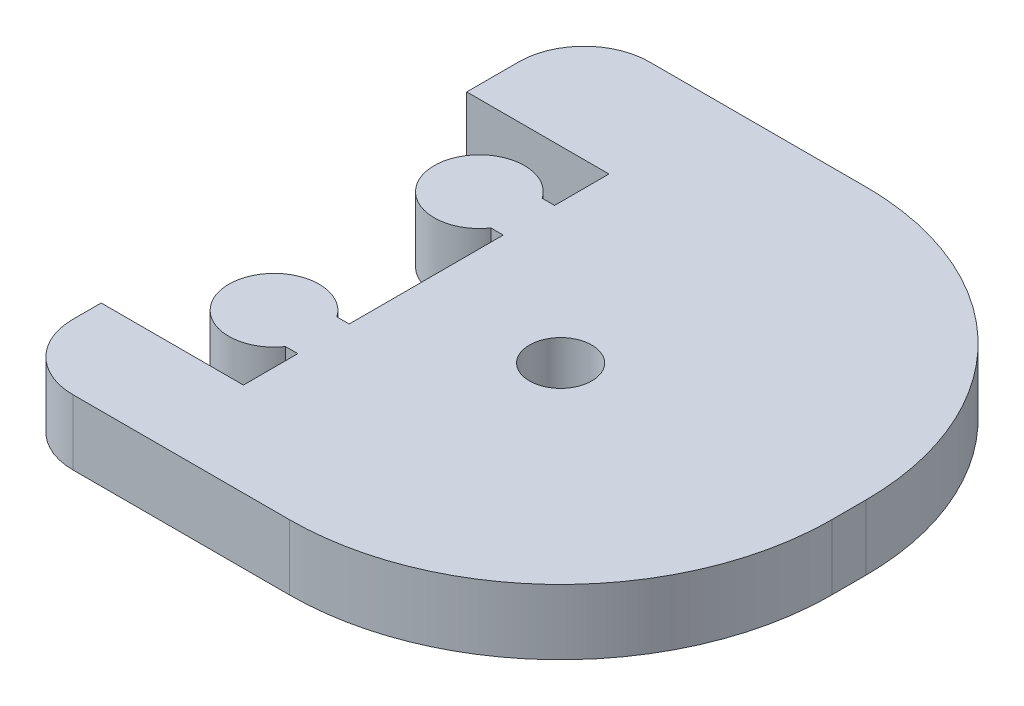
from build123d import *

# Parameters (mm, degrees)
SKETCH1_W           = 50.8
SKETCH1_H           = 21.59
BOSS_EXTRUDE1_DEPTH = 3.175
FILLET1_R           = 10.16
SKETCH3_R           = 1.16713
CUT_EXTRUDE1_DEPTH  = 28.780796425
FILLET3_R           = 10.16
SCALE1_SCALE_X      = 1.3
SCALE1_SCALE_Y      = 1
SCALE1_SCALE_Z      = 1.3
SKETCH4_W           = 39.116
SKETCH4_H           = 28.067
CUT_EXTRUDE2_DEPTH  = 37.032702199
CUT_EXTRUDE3_DEPTH  = 37.032702199
FILLET5_R           = 3.175


with BuildPart() as part:
    # Sketch1 → Boss-Extrude1 (new body)
    with BuildSketch(Plane(origin=(0, 0, 0), x_dir=(1, 0, 0), z_dir=(0, 1, 0))):
        Rectangle(SKETCH1_W, SKETCH1_H)
    extrude(amount=BOSS_EXTRUDE1_DEPTH)

    # Fillet1
    fillet1_edges = [part.edges().sort_by_distance(p)[0] for p in [
        (25.4, 1.5875, 10.795),
        (-25.4, 1.5875, 10.795),
    ]]
    fillet(fillet1_edges, radius=FILLET1_R)

    # Sketch3 → Cut-Extrude1 (cut, through all)
    with BuildSketch(Plane(origin=(0, 3.175, 0), x_dir=(1, 0, 0), z_dir=(0, 1, 0))):
        with Locations(Location((15.24, -0.635, 0), (0, 0, 270))):
            Circle(SKETCH3_R)
        with Locations(Location((-3.81, -0.635, 0), (0, 0, 270))):
            Circle(SKETCH3_R)
    extrude(amount=-CUT_EXTRUDE1_DEPTH, mode=Mode.SUBTRACT)

    # Fillet3
    fillet3_edges = [part.edges().sort_by_distance(p)[0] for p in [
        (-25.4, 1.5875, -10.795),
        (25.4, 1.5875, -10.795),
    ]]
    fillet(fillet3_edges, radius=FILLET3_R)


with BuildPart() as part_1:
    # Scale1: scaled about (-0.04893356, 1.5875, -0.005437062)
    add(part.part.scale((SCALE1_SCALE_X, SCALE1_SCALE_Y, SCALE1_SCALE_Z), about=(-0.04893356, 1.5875, -0.005437062)))

    # Sketch4 → Cut-Extrude2 (cut, through all)
    with BuildSketch(Plane(origin=(0, 3.175, 0), x_dir=(1, 0, 0), z_dir=(0, 1, 0))):
        with Locations((-13.447319932, -0.001631119)):
            Rectangle(SKETCH4_W, SKETCH4_H)
    extrude(amount=-CUT_EXTRUDE2_DEPTH, mode=Mode.SUBTRACT)

    # Sketch5 → Cut-Extrude3 (cut, through all)
    with BuildSketch(Plane(origin=(0, 3.175, 0), x_dir=(1, 0, 0), z_dir=(0, 1, 0))):
        with BuildLine():
            Line((13.035792068, -6.830615627), (13.035792068, -9.480615627))
            Line((13.035792068, -9.480615627), (6.110680068, -9.480615627))
            Line((6.110680068, -9.480615627), (6.110680068, 8.319384373))
            Line((6.110680068, 8.319384373), (13.035792068, 8.319384373))
            Line((13.035792068, 8.319384373), (13.035792068, 5.669384373))
            Line((13.035792068, 5.669384373), (12.435792068, 5.669384373))
            ThreePointArc((12.435792068, 5.669384373), (8.425405369, 4.419384373), (12.435792068, 3.169384373))
            Line((12.435792068, 3.169384373), (13.035792068, 3.169384373))
            Line((13.035792068, 3.169384373), (13.035792068, -4.330615627))
            Line((13.035792068, -4.330615627), (12.435792068, -4.330615627))
            ThreePointArc((12.435792068, -4.330615627), (8.425405369, -5.580615627), (12.435792068, -6.830615627))
            Line((12.435792068, -6.830615627), (13.035792068, -6.830615627))
        make_face()
    extrude(amount=-CUT_EXTRUDE3_DEPTH, mode=Mode.SUBTRACT)

    # Fillet5
    fillet5_edges = [part_1.edges().sort_by_distance(p)[0] for p in [
        (6.110680068, 1.5875, -14.031868881),
        (6.110680068, 1.5875, 14.035131119),
    ]]
    fillet(fillet5_edges, radius=FILLET5_R)


solid = part_1.part
